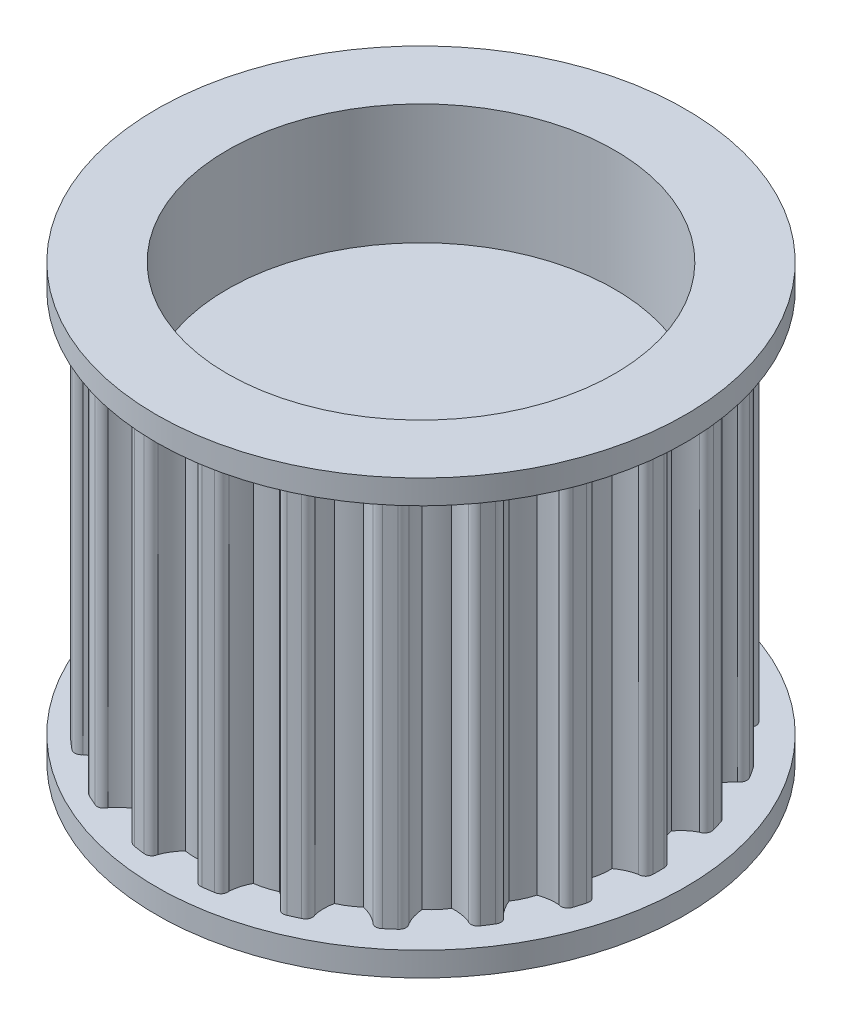
from build123d import *

# Parameters (mm, degrees)
BOSS_EXTRUDE1_DEPTH = 16
SKETCH2_R           = 11
BOSS_EXTRUDE2_DEPTH = 1
BOSS_EXTRUDE3_START = 1
SKETCH3_R           = 11
BOSS_EXTRUDE3_DEPTH = 1
SKETCH4_R           = 8.05
CUT_EXTRUDE1_DEPTH  = 5
CUT_EXTRUDE2_START  = -5
SKETCH5_R           = 8.05
CUT_EXTRUDE2_DEPTH  = 5


with BuildPart() as part:
    # Sketch1 → Boss-Extrude1 (new body)
    with BuildSketch(Plane(origin=(0, 0, 0), x_dir=(1, 0, 0), z_dir=(0, 1, 0))):
        with BuildLine():
            ThreePointArc((-3.858731632, 9.152099082), (-4.037651266, 9.321902159), (-4.281438065, 9.284308058))
            ThreePointArc((-4.281438065, 9.284308058), (-4.268277755, 9.29344918), (-4.255080151, 9.302536377))
            ThreePointArc((-4.255080151, 9.302536377), (-4.463852821, 9.210023953), (-4.670486069, 9.11282685))
            ThreePointArc((-4.670486069, 9.11282685), (-4.654975831, 9.116850086), (-4.639449262, 9.120809822))
            ThreePointArc((-4.639449262, 9.120809822), (-4.827507571, 8.961186968), (-4.816346406, 8.714771036))
            ThreePointArc((-4.816346406, 8.714771036), (-4.781990792, 8.504459815), (-4.770494306, 8.291671309))
            ThreePointArc((-4.770494306, 8.291671309), (-4.78074316, 8.090728694), (-4.811383354, 7.891871579))
            ThreePointArc((-4.811383354, 7.891871579), (-5.196529681, 7.684851022), (-5.54483777, 7.420509047))
            ThreePointArc((-5.54483777, 7.420509047), (-5.936314436, 7.55437863), (-6.291311895, 7.766868273))
            ThreePointArc((-6.291311895, 7.766868273), (-6.510823081, 7.879385647), (-6.73414332, 7.774631692))
            ThreePointArc((-6.73414332, 7.774631692), (-6.724091446, 7.787110223), (-6.713988597, 7.799547519))
            ThreePointArc((-6.713988597, 7.799547519), (-6.888240745, 7.65196444), (-7.059120307, 7.50048919))
            ThreePointArc((-7.059120307, 7.50048919), (-7.045371819, 7.508719195), (-7.031589771, 7.516892875))
            ThreePointArc((-7.031589771, 7.516892875), (-7.167059443, 7.310753719), (-7.086926993, 7.077463827))
            ThreePointArc((-7.086926993, 7.077463827), (-6.927121539, 6.695839386), (-6.850327411, 6.289295834))
            ThreePointArc((-6.850327411, 6.289295834), (-7.161548176, 5.982152805), (-7.421273599, 5.630388808))
            ThreePointArc((-7.421273599, 5.630388808), (-7.834608129, 5.64854401), (-8.235090947, 5.752411988))
            ThreePointArc((-8.235090947, 5.752411988), (-8.477410195, 5.79852817), (-8.662171795, 5.635100905))
            ThreePointArc((-8.662171795, 5.635100905), (-8.656042702, 5.649905907), (-8.64985308, 5.664685707))
            ThreePointArc((-8.64985308, 5.664685707), (-8.775467834, 5.473988277), (-8.896750063, 5.280506503))
            ThreePointArc((-8.896750063, 5.280506503), (-8.885877146, 5.292276531), (-8.87495616, 5.304001971))
            ThreePointArc((-8.87495616, 5.304001971), (-8.946862246, 5.068046683), (-8.804250366, 4.86678259))
            ThreePointArc((-8.804250366, 4.86678259), (-8.543402126, 4.545639019), (-8.355182146, 4.177198744))
            ThreePointArc((-8.355182146, 4.177198744), (-8.567264091, 3.794816144), (-8.71736544, 3.384127953))
            ThreePointArc((-8.71736544, 3.384127953), (-9.119071929, 3.285097948), (-9.53259537, 3.271929495))
            ThreePointArc((-9.53259537, 3.271929495), (-9.778091415, 3.247908426), (-9.909326092, 3.039047755))
            ThreePointArc((-9.909326092, 3.039047755), (-9.907616321, 3.054979816), (-9.905841373, 3.070904748))
            ThreePointArc((-9.905841373, 3.070904748), (-9.972642172, 2.852542138), (-10.034501504, 2.632728583))
            ThreePointArc((-10.034501504, 2.632728583), (-10.027385016, 2.647085097), (-10.020209845, 2.661412372))
            ThreePointArc((-10.020209845, 2.661412372), (-10.022726943, 2.414756645), (-9.829189198, 2.261823572))
            ThreePointArc((-9.829189198, 2.261823572), (-9.488430546, 2.027178014), (-9.204033176, 1.726689855))
            ThreePointArc((-9.204033176, 1.726689855), (-9.299794686, 1.300046048), (-9.328111641, 0.863705178))
            ThreePointArc((-9.328111641, 0.863705178), (-9.685646218, 0.655512788), (-10.078709072, 0.526374733))
            ThreePointArc((-10.078709072, 0.526374733), (-10.307493286, 0.434162458), (-10.374569184, 0.19678903))
            ThreePointArc((-10.374569184, 0.19678903), (-10.377417251, 0.212557429), (-10.380200773, 0.22833735))
            ThreePointArc((-10.380200773, 0.22833735), (-10.382132033, 0.114175934), (-10.382775814, 0))
            ThreePointArc((-10.382775814, 0), (-10.382132033, -0.114175934), (-10.380200773, -0.22833735))
            ThreePointArc((-10.380200773, -0.22833735), (-10.377417251, -0.212557429), (-10.374569184, -0.19678903))
            ThreePointArc((-10.374569184, -0.19678903), (-10.307493374, -0.434162615), (-10.078709042, -0.52637494))
            ThreePointArc((-10.078709042, -0.52637494), (-9.685646216, -0.655512899), (-9.328111641, -0.863705178))
            ThreePointArc((-9.328111641, -0.863705178), (-9.299794686, -1.300046048), (-9.204033176, -1.726689855))
            ThreePointArc((-9.204033176, -1.726689855), (-9.488430516, -2.02717812), (-9.829189169, -2.261823779))
            ThreePointArc((-9.829189169, -2.261823779), (-10.022726814, -2.414756771), (-10.020209845, -2.661412372))
            ThreePointArc((-10.020209845, -2.661412372), (-10.027385016, -2.647085097), (-10.034501504, -2.632728583))
            ThreePointArc((-10.034501504, -2.632728583), (-9.972642172, -2.852542138), (-9.905841373, -3.070904748))
            ThreePointArc((-9.905841373, -3.070904748), (-9.907616321, -3.054979816), (-9.909326092, -3.039047755))
            ThreePointArc((-9.909326092, -3.039047755), (-9.778091455, -3.247908602), (-9.532595283, -3.271929686))
            ThreePointArc((-9.532595283, -3.271929686), (-9.119071896, -3.285098054), (-8.71736544, -3.384127953))
            ThreePointArc((-8.71736544, -3.384127953), (-8.567264091, -3.794816144), (-8.355182146, -4.177198744))
            ThreePointArc((-8.355182146, -4.177198744), (-8.543402068, -4.545639113), (-8.804250279, -4.866782781))
            ThreePointArc((-8.804250279, -4.866782781), (-8.946862087, -5.068046768), (-8.87495616, -5.304001971))
            ThreePointArc((-8.87495616, -5.304001971), (-8.885877146, -5.292276531), (-8.896750063, -5.280506503))
            ThreePointArc((-8.896750063, -5.280506503), (-8.775467834, -5.473988277), (-8.64985308, -5.664685707))
            ThreePointArc((-8.64985308, -5.664685707), (-8.656042702, -5.649905907), (-8.662171795, -5.635100905))
            ThreePointArc((-8.662171795, -5.635100905), (-8.477410184, -5.798528351), (-8.23509081, -5.752412147))
            ThreePointArc((-8.23509081, -5.752412147), (-7.834608067, -5.648544103), (-7.421273599, -5.630388808))
            ThreePointArc((-7.421273599, -5.630388808), (-7.161548176, -5.982152805), (-6.850327411, -6.289295834))
            ThreePointArc((-6.850327411, -6.289295834), (-6.927121456, -6.695839459), (-7.086926856, -7.077463985))
            ThreePointArc((-7.086926856, -7.077463985), (-7.167059266, -7.310753756), (-7.031589771, -7.516892875))
            ThreePointArc((-7.031589771, -7.516892875), (-7.045371819, -7.508719195), (-7.059120307, -7.50048919))
            ThreePointArc((-7.059120307, -7.50048919), (-6.888240745, -7.65196444), (-6.713988597, -7.799547519))
            ThreePointArc((-6.713988597, -7.799547519), (-6.724091446, -7.787110223), (-6.73414332, -7.774631692))
            ThreePointArc((-6.73414332, -7.774631692), (-6.510823019, -7.879385817), (-6.291311718, -7.766868387))
            ThreePointArc((-6.291311718, -7.766868387), (-5.936314351, -7.554378701), (-5.54483777, -7.420509047))
            ThreePointArc((-5.54483777, -7.420509047), (-5.196529681, -7.684851022), (-4.811383354, -7.891871579))
            ThreePointArc((-4.811383354, -7.891871579), (-4.780743087, -8.090728926), (-4.770494209, -8.291671781))
            ThreePointArc((-4.770494209, -8.291671781), (-4.781990674, -8.504460105), (-4.81634623, -8.714771149))
            ThreePointArc((-4.81634623, -8.714771149), (-4.827507391, -8.961186954), (-4.639449262, -9.120809822))
            ThreePointArc((-4.639449262, -9.120809822), (-4.654975831, -9.116850086), (-4.670486069, -9.11282685))
            ThreePointArc((-4.670486069, -9.11282685), (-4.463852821, -9.210023953), (-4.255080151, -9.302536377))
            ThreePointArc((-4.255080151, -9.302536377), (-4.268277755, -9.29344918), (-4.281438065, -9.284308058))
            ThreePointArc((-4.281438065, -9.284308058), (-4.037651159, -9.321902305), (-3.858731431, -9.152099141))
            ThreePointArc((-3.858731431, -9.152099141), (-3.577979214, -8.848202465), (-3.240075625, -8.609463775))
            ThreePointArc((-3.240075625, -8.609463775), (-2.831402721, -8.764968314), (-2.403533095, -8.855094824))
            ThreePointArc((-2.403533095, -8.855094824), (-2.248342279, -9.23861908), (-2.176457339, -9.646059383))
            ThreePointArc((-2.176457339, -9.646059383), (-2.11774304, -9.885638078), (-1.892331628, -9.985813002))
            ThreePointArc((-1.892331628, -9.985813002), (-1.908344849, -9.986388003), (-1.92436029, -9.986897475))
            ThreePointArc((-1.92436029, -9.986897475), (-1.698713551, -10.021942099), (-1.47233388, -10.051889061))
            ThreePointArc((-1.47233388, -10.051889061), (-1.487557048, -10.046888155), (-1.502759625, -10.041825))
            ThreePointArc((-1.502759625, -10.041825), (-1.258256277, -10.009213708), (-1.134423135, -9.795881253))
            ThreePointArc((-1.134423135, -9.795881253), (-0.950660943, -9.425197487), (-0.693705286, -9.100930949))
            ThreePointArc((-0.693705286, -9.100930949), (-0.257775814, -9.135), (0.178153658, -9.100930949))
            ThreePointArc((0.178153658, -9.100930949), (0.435109425, -9.425197473), (0.618871717, -9.795881253))
            ThreePointArc((0.618871717, -9.795881253), (0.742704793, -10.009213598), (0.987207997, -10.041825))
            ThreePointArc((0.987207997, -10.041825), (0.97200542, -10.046888155), (0.956782252, -10.051889061))
            ThreePointArc((0.956782252, -10.051889061), (1.183161924, -10.021942099), (1.408808662, -9.986897475))
            ThreePointArc((1.408808662, -9.986897475), (1.392793221, -9.986388003), (1.37678, -9.985813002))
            ThreePointArc((1.37678, -9.985813002), (1.58159899, -9.907724242), (1.667400192, -9.706014483))
            ThreePointArc((1.667400192, -9.706014483), (1.665771888, -9.675861553), (1.660905913, -9.646059324))
            ThreePointArc((1.660905913, -9.646059324), (1.73279076, -9.238619063), (1.887981467, -8.855094824))
            ThreePointArc((1.887981467, -8.855094824), (2.315851093, -8.764968314), (2.724523997, -8.609463775))
            ThreePointArc((2.724523997, -8.609463775), (3.062427687, -8.84820242), (3.343180004, -9.152099082))
            ThreePointArc((3.343180004, -9.152099082), (3.522099638, -9.321902159), (3.765886437, -9.284308058))
            ThreePointArc((3.765886437, -9.284308058), (3.752726127, -9.29344918), (3.739528523, -9.302536377))
            ThreePointArc((3.739528523, -9.302536377), (3.948301193, -9.210023953), (4.154934441, -9.11282685))
            ThreePointArc((4.154934441, -9.11282685), (4.139424204, -9.116850086), (4.123897634, -9.120809822))
            ThreePointArc((4.123897634, -9.120809822), (4.276187707, -9.021372329), (4.335259281, -8.849353055))
            ThreePointArc((4.335259281, -8.849353055), (4.326506345, -8.779890616), (4.300794778, -8.714771036))
            ThreePointArc((4.300794778, -8.714771036), (4.254978598, -8.303582666), (4.295831726, -7.891871579))
            ThreePointArc((4.295831726, -7.891871579), (4.680978054, -7.684851022), (5.029286143, -7.420509047))
            ThreePointArc((5.029286143, -7.420509047), (5.420762808, -7.55437863), (5.775760267, -7.766868273))
            ThreePointArc((5.775760267, -7.766868273), (5.995271453, -7.879385647), (6.218591692, -7.774631692))
            ThreePointArc((6.218591692, -7.774631692), (6.208539818, -7.787110223), (6.198436969, -7.799547519))
            ThreePointArc((6.198436969, -7.799547519), (6.372689117, -7.65196444), (6.543568679, -7.50048919))
            ThreePointArc((6.543568679, -7.50048919), (6.529820191, -7.508719195), (6.516038143, -7.516892875))
            ThreePointArc((6.516038143, -7.516892875), (6.616862506, -7.414596645), (6.653701918, -7.275769672))
            ThreePointArc((6.653701918, -7.275769672), (6.632302541, -7.168411778), (6.571375365, -7.077463827))
            ThreePointArc((6.571375365, -7.077463827), (6.411569911, -6.695839386), (6.334775783, -6.289295834))
            ThreePointArc((6.334775783, -6.289295834), (6.645996548, -5.982152805), (6.905721971, -5.630388808))
            ThreePointArc((6.905721971, -5.630388808), (7.319056501, -5.64854401), (7.719539319, -5.752411988))
            ThreePointArc((7.719539319, -5.752411988), (7.961858567, -5.79852817), (8.146620168, -5.635100905))
            ThreePointArc((8.146620168, -5.635100905), (8.140491074, -5.649905907), (8.134301452, -5.664685707))
            ThreePointArc((8.134301452, -5.664685707), (8.259916206, -5.473988277), (8.381198435, -5.280506503))
            ThreePointArc((8.381198435, -5.280506503), (8.370325518, -5.292276531), (8.359404532, -5.304001971))
            ThreePointArc((8.359404532, -5.304001971), (8.415344369, -5.215555256), (8.434901667, -5.112746701))
            ThreePointArc((8.434901667, -5.112746701), (8.395591488, -4.96967885), (8.288698738, -4.86678259))
            ThreePointArc((8.288698738, -4.86678259), (8.027850498, -4.545639019), (7.839630518, -4.177198744))
            ThreePointArc((7.839630518, -4.177198744), (8.051712464, -3.794816144), (8.201813812, -3.384127953))
            ThreePointArc((8.201813812, -3.384127953), (8.603520301, -3.285097948), (9.017043742, -3.271929495))
            ThreePointArc((9.017043742, -3.271929495), (9.262539788, -3.247908426), (9.393774464, -3.039047755))
            ThreePointArc((9.393774464, -3.039047755), (9.392064693, -3.054979816), (9.390289745, -3.070904748))
            ThreePointArc((9.390289745, -3.070904748), (9.457090544, -2.852542138), (9.518949876, -2.632728583))
            ThreePointArc((9.518949876, -2.632728583), (9.511833389, -2.647085097), (9.504658217, -2.661412372))
            ThreePointArc((9.504658217, -2.661412372), (9.526979273, -2.60021665), (9.534556319, -2.535519399))
            ThreePointArc((9.534556319, -2.535519399), (9.472435586, -2.359654039), (9.313637571, -2.261823572))
            ThreePointArc((9.313637571, -2.261823572), (8.972878918, -2.027178014), (8.688481549, -1.726689855))
            ThreePointArc((8.688481549, -1.726689855), (8.781549356, -1.318352466), (8.812804046, -0.900711252))
            ThreePointArc((8.812804046, -0.900711252), (8.812743037, -0.882207813), (8.812560013, -0.863705178))
            ThreePointArc((8.812560013, -0.863705178), (9.17009459, -0.655512788), (9.563157444, -0.526374733))
            ThreePointArc((9.563157444, -0.526374733), (9.7742117, -0.452203126), (9.863578355, -0.247120393))
            ThreePointArc((9.863578355, -0.247120393), (9.862435824, -0.221851603), (9.859017556, -0.19678903))
            ThreePointArc((9.859017556, -0.19678903), (9.861865623, -0.212557429), (9.864649145, -0.22833735))
            ThreePointArc((9.864649145, -0.22833735), (9.867224186, 0), (9.864649145, 0.22833735))
            ThreePointArc((9.864649145, 0.22833735), (9.861865623, 0.212557429), (9.859017556, 0.19678903))
            ThreePointArc((9.859017556, 0.19678903), (9.862435853, 0.221851708), (9.863578393, 0.247120605))
            ThreePointArc((9.863578393, 0.247120605), (9.774211714, 0.452203362), (9.563157414, 0.52637494))
            ThreePointArc((9.563157414, 0.52637494), (9.170094588, 0.655512899), (8.812560013, 0.863705178))
            ThreePointArc((8.812560013, 0.863705178), (8.812743037, 0.882207813), (8.812804046, 0.900711252))
            ThreePointArc((8.812804046, 0.900711252), (8.781549356, 1.318352466), (8.688481549, 1.726689855))
            ThreePointArc((8.688481549, 1.726689855), (8.972878888, 2.02717812), (9.313637541, 2.261823779))
            ThreePointArc((9.313637541, 2.261823779), (9.472435511, 2.359654259), (9.534556222, 2.535519592))
            ThreePointArc((9.534556222, 2.535519592), (9.5269792, 2.600216738), (9.504658217, 2.661412372))
            ThreePointArc((9.504658217, 2.661412372), (9.511833389, 2.647085097), (9.518949876, 2.632728583))
            ThreePointArc((9.518949876, 2.632728583), (9.457090544, 2.852542138), (9.390289745, 3.070904748))
            ThreePointArc((9.390289745, 3.070904748), (9.392064693, 3.054979816), (9.393774464, 3.039047755))
            ThreePointArc((9.393774464, 3.039047755), (9.262539828, 3.247908602), (9.017043655, 3.271929686))
            ThreePointArc((9.017043655, 3.271929686), (8.603520268, 3.285098054), (8.201813812, 3.384127953))
            ThreePointArc((8.201813812, 3.384127953), (8.051712464, 3.794816144), (7.839630518, 4.177198744))
            ThreePointArc((7.839630518, 4.177198744), (8.02785044, 4.545639113), (8.288698651, 4.866782781))
            ThreePointArc((8.288698651, 4.866782781), (8.395591358, 4.969679037), (8.434901519, 5.112746859))
            ThreePointArc((8.434901519, 5.112746859), (8.415344261, 5.215555313), (8.359404532, 5.304001971))
            ThreePointArc((8.359404532, 5.304001971), (8.370325518, 5.292276531), (8.381198435, 5.280506503))
            ThreePointArc((8.381198435, 5.280506503), (8.259916206, 5.473988277), (8.134301452, 5.664685707))
            ThreePointArc((8.134301452, 5.664685707), (8.140491074, 5.649905907), (8.146620168, 5.635100905))
            ThreePointArc((8.146620168, 5.635100905), (7.961858556, 5.798528351), (7.719539182, 5.752412147))
            ThreePointArc((7.719539182, 5.752412147), (7.31905644, 5.648544103), (6.905721971, 5.630388808))
            ThreePointArc((6.905721971, 5.630388808), (6.645996548, 5.982152805), (6.334775783, 6.289295834))
            ThreePointArc((6.334775783, 6.289295834), (6.411569829, 6.695839459), (6.571375228, 7.077463985))
            ThreePointArc((6.571375228, 7.077463985), (6.632302369, 7.16841192), (6.653701732, 7.275769782))
            ThreePointArc((6.653701732, 7.275769782), (6.616862373, 7.414596661), (6.516038143, 7.516892875))
            ThreePointArc((6.516038143, 7.516892875), (6.529820191, 7.508719195), (6.543568679, 7.50048919))
            ThreePointArc((6.543568679, 7.50048919), (6.372689117, 7.65196444), (6.198436969, 7.799547519))
            ThreePointArc((6.198436969, 7.799547519), (6.208539818, 7.787110223), (6.218591692, 7.774631692))
            ThreePointArc((6.218591692, 7.774631692), (5.995271391, 7.879385817), (5.775760091, 7.766868387))
            ThreePointArc((5.775760091, 7.766868387), (5.420762723, 7.554378701), (5.029286143, 7.420509047))
            ThreePointArc((5.029286143, 7.420509047), (4.680978054, 7.684851022), (4.295831726, 7.891871579))
            ThreePointArc((4.295831726, 7.891871579), (4.254978498, 8.303582714), (4.300794602, 8.714771149))
            ThreePointArc((4.300794602, 8.714771149), (4.326506144, 8.779890702), (4.335259072, 8.849353108))
            ThreePointArc((4.335259072, 8.849353108), (4.276187564, 9.021372297), (4.123897634, 9.120809822))
            ThreePointArc((4.123897634, 9.120809822), (4.139424204, 9.116850086), (4.154934441, 9.11282685))
            ThreePointArc((4.154934441, 9.11282685), (3.948301193, 9.210023953), (3.739528523, 9.302536377))
            ThreePointArc((3.739528523, 9.302536377), (3.752726127, 9.29344918), (3.765886437, 9.284308058))
            ThreePointArc((3.765886437, 9.284308058), (3.522099531, 9.321902305), (3.343179803, 9.152099141))
            ThreePointArc((3.343179803, 9.152099141), (3.062427586, 8.848202465), (2.724523997, 8.609463775))
            ThreePointArc((2.724523997, 8.609463775), (2.315851093, 8.764968314), (1.887981467, 8.855094824))
            ThreePointArc((1.887981467, 8.855094824), (1.732790651, 9.23861908), (1.660905712, 9.646059383))
            ThreePointArc((1.660905712, 9.646059383), (1.665771676, 9.675861579), (1.667399977, 9.706014474))
            ThreePointArc((1.667399977, 9.706014474), (1.581598852, 9.907724159), (1.37678, 9.985813002))
            ThreePointArc((1.37678, 9.985813002), (1.392793221, 9.986388003), (1.408808662, 9.986897475))
            ThreePointArc((1.408808662, 9.986897475), (1.183161924, 10.021942099), (0.956782252, 10.051889061))
            ThreePointArc((0.956782252, 10.051889061), (0.97200542, 10.046888155), (0.987207997, 10.041825))
            ThreePointArc((0.987207997, 10.041825), (0.742704649, 10.009213708), (0.618871508, 9.795881253))
            ThreePointArc((0.618871508, 9.795881253), (0.435109315, 9.425197487), (0.178153658, 9.100930949))
            ThreePointArc((0.178153658, 9.100930949), (-0.257775814, 9.135), (-0.693705286, 9.100930949))
            ThreePointArc((-0.693705286, 9.100930949), (-0.950661053, 9.425197473), (-1.134423345, 9.795881253))
            ThreePointArc((-1.134423345, 9.795881253), (-1.258256421, 10.009213598), (-1.502759625, 10.041825))
            ThreePointArc((-1.502759625, 10.041825), (-1.487557048, 10.046888155), (-1.47233388, 10.051889061))
            ThreePointArc((-1.47233388, 10.051889061), (-1.698713551, 10.021942099), (-1.92436029, 9.986897475))
            ThreePointArc((-1.92436029, 9.986897475), (-1.908344849, 9.986388003), (-1.892331628, 9.985813002))
            ThreePointArc((-1.892331628, 9.985813002), (-2.117743209, 9.885638143), (-2.17645754, 9.646059324))
            ThreePointArc((-2.17645754, 9.646059324), (-2.248342388, 9.238619063), (-2.403533095, 8.855094824))
            ThreePointArc((-2.403533095, 8.855094824), (-2.831402721, 8.764968314), (-3.240075625, 8.609463775))
            ThreePointArc((-3.240075625, 8.609463775), (-3.577979315, 8.84820242), (-3.858731632, 9.152099082))
        make_face()
    extrude(amount=BOSS_EXTRUDE1_DEPTH)

    # Sketch2 → Boss-Extrude2 (add)
    with BuildSketch(Plane(origin=(0, 16, 0), x_dir=(1, 0, 0), z_dir=(0, 1, 0))):
        with Locations(Location((0, 0, 0), (0, 0, 270))):
            Circle(SKETCH2_R)
    extrude(amount=BOSS_EXTRUDE2_DEPTH)

    # Sketch3 → Boss-Extrude3 (add)
    with BuildSketch(Plane.XZ.offset(BOSS_EXTRUDE3_START)):
        with Locations(Location((0, 0, 0), (0, 0, 90))):
            Circle(SKETCH3_R)
    extrude(amount=-BOSS_EXTRUDE3_DEPTH)

    # Sketch4 → Cut-Extrude1 (cut)
    with BuildSketch(Plane.XZ.offset(1)):
        with Locations(Location((0, 0, 0), (0, 0, 270))):
            Circle(SKETCH4_R)
    extrude(amount=-CUT_EXTRUDE1_DEPTH, mode=Mode.SUBTRACT)

    # Sketch5 → Cut-Extrude2 (cut)
    with BuildSketch(Plane(origin=(0, 17, 0), x_dir=(1, 0, 0), z_dir=(0, 1, 0)).offset(CUT_EXTRUDE2_START)):
        with Locations(Location((0, 0, 0), (0, 0, 90))):
            Circle(SKETCH5_R)
    extrude(amount=CUT_EXTRUDE2_DEPTH, mode=Mode.SUBTRACT)


solid = part.part
